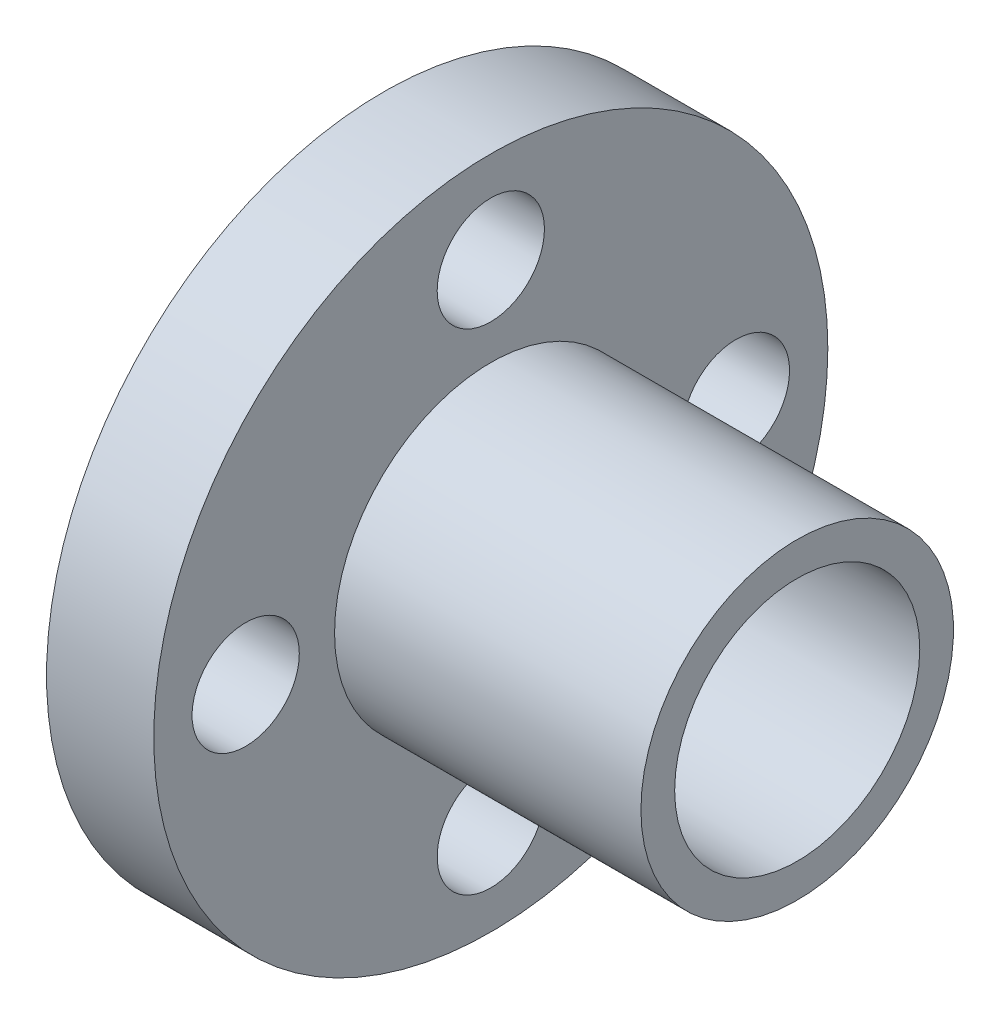
from build123d import *

# Parameters (mm, degrees)
SKETCH_1_R               = 11
EXTRUDE_1_DEPTH          = 3.5
EXTRUDE_2_DEPTH          = 1.5
EXTRUDE_2_DEPTH_BACK     = 13.5
SKETCH_2_R               = 5.1
SKETCH_3_R               = 4
CUT_EXTRUDE_1_DEPTH      = 22.610182785
SKETCH_4_R               = 1.75
CUT_EXTRUDE_2_DEPTH      = 21.597329924
PATTERN_CIRCULAR_1_COUNT = 4


with BuildPart() as part:
    # 草图1 → 凸台-拉伸1 (new body)
    with BuildSketch(Plane(origin=(0, 0, 0), x_dir=(0, 0, -1), z_dir=(1, 0, 0))):
        Circle(SKETCH_1_R)
    extrude(amount=EXTRUDE_1_DEPTH)

    # 草图2 → 凸台-拉伸2 (add, two sides: drawn at the far end of the back side and taken through both)
    with BuildSketch(Plane.ZY.offset(-EXTRUDE_2_DEPTH_BACK)):
        Circle(SKETCH_2_R)
    extrude(amount=EXTRUDE_2_DEPTH + EXTRUDE_2_DEPTH_BACK)

    # 草图3 → 切除-拉伸1 (cut, through all)
    with BuildSketch(Plane.ZY.offset(1.5)):
        Circle(SKETCH_3_R)
    extrude(amount=-CUT_EXTRUDE_1_DEPTH, mode=Mode.SUBTRACT)

    # 草图4 → 切除-拉伸2 (cut, through all)
    with BuildSketch(Plane.ZY):
        with Locations((0, 8)):
            Circle(SKETCH_4_R)
    cut_extrude_2 = extrude(amount=-CUT_EXTRUDE_2_DEPTH, mode=Mode.SUBTRACT)

    # 阵列(圆周)1: 切除-拉伸2 ×4 about axis
    pattern_circular_1_axis = Axis((0, 0, 0), (1, 0, 0))
    for i in range(1, PATTERN_CIRCULAR_1_COUNT):
        add(cut_extrude_2.rotate(pattern_circular_1_axis, i * 360 / PATTERN_CIRCULAR_1_COUNT), mode=Mode.SUBTRACT)


solid = part.part
